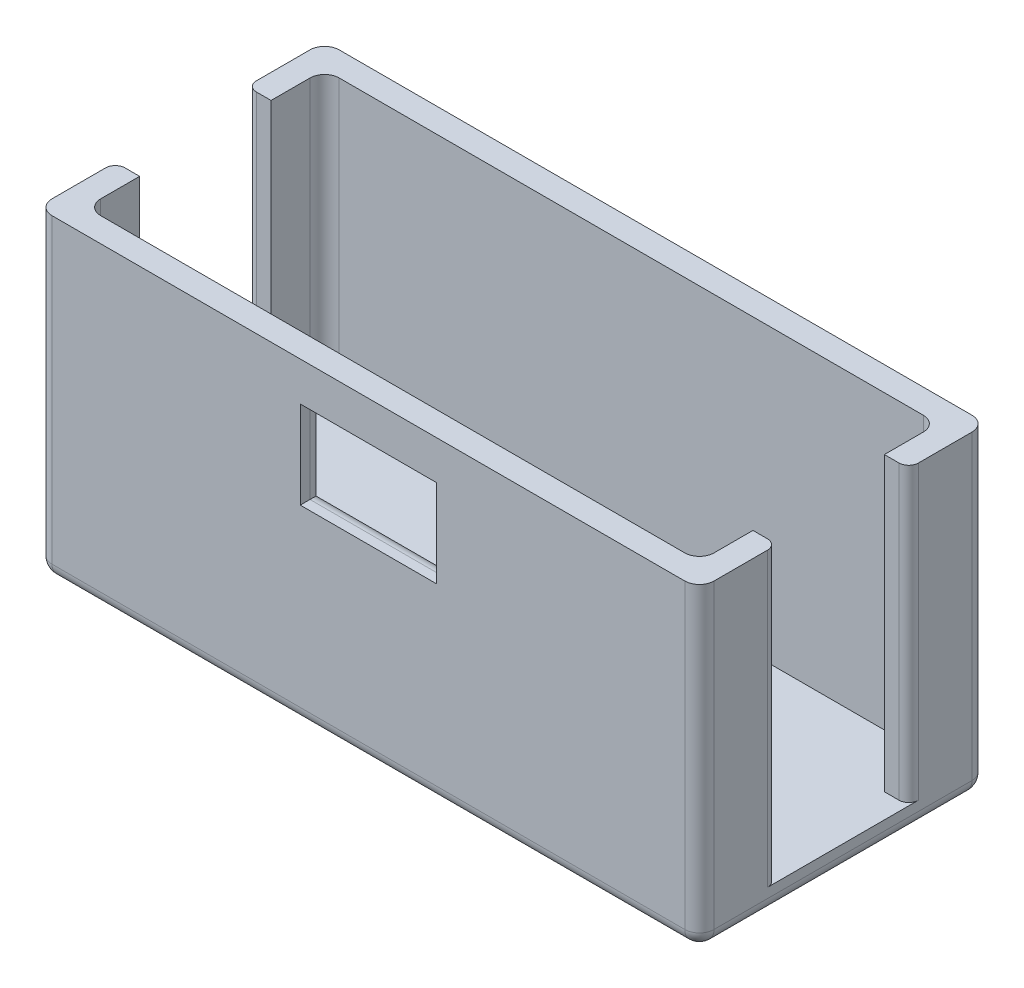
from build123d import *

# Parameters (mm, degrees)
SKETCH1_W           = 68
SKETCH1_H           = 29.5
BOSS_EXTRUDE1_DEPTH = 2.5
BOSS_EXTRUDE2_DEPTH = 30
CUT_EXTRUDE1_DEPTH  = 50.5
FILLET1_R           = 1.5
FILLET2_R           = 1


with BuildPart() as part:
    # Sketch1 → Boss-Extrude1 (new body)
    with BuildSketch(Plane(origin=(0, 0, 0), x_dir=(1, 0, 0), z_dir=(0, 1, 0))):
        Rectangle(SKETCH1_W, SKETCH1_H)
    extrude(amount=BOSS_EXTRUDE1_DEPTH)

    # Sketch2 → Boss-Extrude2 (add)
    with BuildSketch(Plane(origin=(0, 2.5, 0), x_dir=(1, 0, 0), z_dir=(0, 1, 0))):
        Polygon((-31.5, -6.75), (-34, -6.75), (-34, -14.75), (0, -14.75), (0, -12.25), (-31.5, -12.25), align=None)
        Polygon((0, -12.25), (0, -14.75), (34, -14.75), (34, -6.75), (31.5, -6.75), (31.5, -12.25), align=None)
        Polygon((34, 14.75), (0, 14.75), (0, 12.25), (31.5, 12.25), (31.5, 6.75), (34, 6.75), align=None)
        Polygon((0, 14.75), (-34, 14.75), (-34, 6.75), (-31.5, 6.75), (-31.5, 12.25), (0, 12.25), align=None)
    extrude(amount=BOSS_EXTRUDE2_DEPTH)

    # Sketch3 → Cut-Extrude1 (cut)
    with BuildSketch(Plane.XY.offset(-12.25)):
        Polygon((7, 19.5), (7, 28.5), (0, 28.5), (-7, 28.5), (-7, 19.5), align=None)
    extrude(amount=CUT_EXTRUDE1_DEPTH, mode=Mode.SUBTRACT)

    # Fillet1
    fillet1_edges = [part.edges().sort_by_distance(p)[0] for p in [
        (0, 0, 14.75),
        (-34, 0, 0),
        (-34, 16.25, -14.75),
        (34, 16.25, -14.75),
        (34, 16.25, 14.75),
        (-34, 16.25, 14.75),
        (31.5, 17.5, 12.25),
        (-31.5, 17.5, 12.25),
        (-31.5, 17.5, -12.25),
        (31.5, 17.5, -12.25),
        (7, 24, 12.25),
        (0, 28.5, 12.25),
        (-7, 24, 12.25),
        (0, 19.5, 12.25),
        (0, 0, -14.75),
        (34, 0, 0),
    ]]
    fillet(fillet1_edges, radius=FILLET1_R)

    # Fillet2
    fillet2_edges = [part.edges().sort_by_distance(p)[0] for p in [
        (-34, 17.5, 6.75),
        (34, 17.5, 6.75),
        (34, 17.5, -6.75),
        (-34, 17.5, -6.75),
    ]]
    fillet(fillet2_edges, radius=FILLET2_R)


solid = part.part
